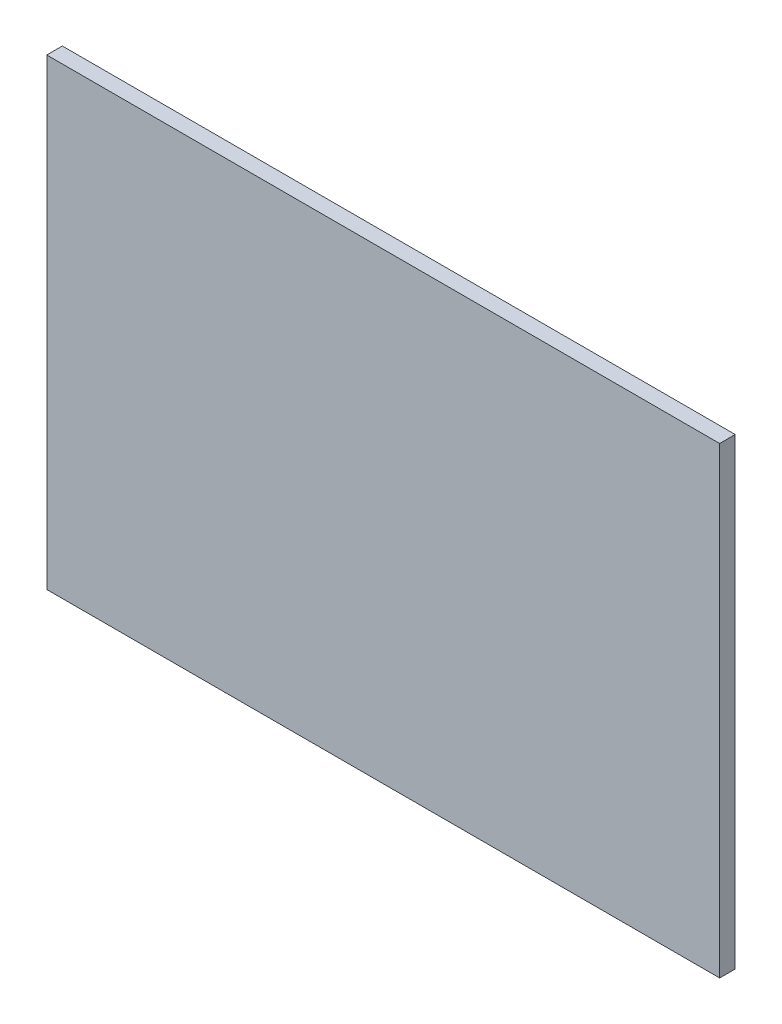
from build123d import *

# Parameters (mm, degrees)
SKETCH1_W           = 823.37148
SKETCH1_H           = 566.42
BOSS_EXTRUDE1_DEPTH = 19.05


with BuildPart() as part:
    # Sketch1 → Boss-Extrude1 (new body)
    with BuildSketch(Plane.XY):
        with Locations((3371.614631353, 1497.751357012)):
            Rectangle(SKETCH1_W, SKETCH1_H)
    extrude(amount=BOSS_EXTRUDE1_DEPTH)


solid = part.part
